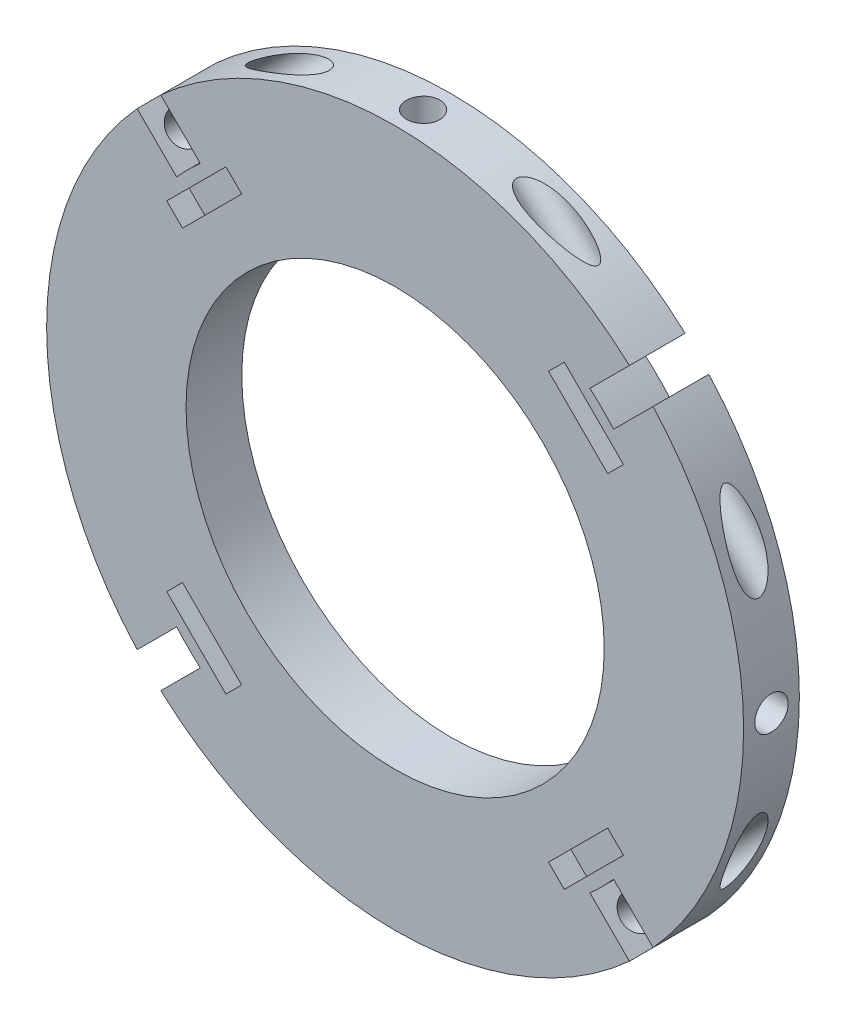
from build123d import *

# Parameters (mm, degrees)
SKETCH1_R                 = 62.5
SKETCH1_R_2               = 37.5
BOSS_EXTRUDE1_DEPTH       = 5
KANAT_B_LMESI_DEPTH       = 10
SKETCH3_R                 = 3
KANAT_TUTUCU_DELI_I_DEPTH = 54.5
MERKEZLEME_START          = 55
SKETCH4_R                 = 3
MERKEZLEME_DELI_I_DEPTH   = 8
MD_AYNA_COUNT             = 4
KB_AYNA_COUNT             = 4
CUT_EXTRUDE4_DEPTH        = 4
CIRPATTERN4_COUNT         = 4


with BuildPart() as part:
    # Sketch1 → Boss-Extrude1 (new, symmetric)
    with BuildSketch(Plane.XY):
        Circle(SKETCH1_R)
        Circle(SKETCH1_R_2, mode=Mode.SUBTRACT)
    extrude(amount=BOSS_EXTRUDE1_DEPTH, both=True)

    # Sketch2 → Kanat Bölmesi (cut)
    with BuildSketch(Plane.XY.offset(5)):
        with BuildLine():
            ThreePointArc((46.264553121, 42.021912433), (44.194173824, 44.194173824), (42.021912433, 46.264553121))
            Line((42.021912433, 46.264553121), (34.941126958, 39.183767645))
            ThreePointArc((34.941126958, 39.183767645), (37.123106012, 37.123106012), (39.183767645, 34.941126958))
            Line((39.183767645, 34.941126958), (46.264553121, 42.021912433))
        make_face()
    kanat_b_lmesi = extrude(amount=-KANAT_B_LMESI_DEPTH, mode=Mode.SUBTRACT)

    # Sketch3 → Kanat Tutucu Deliği (cut, symmetric)
    with BuildSketch(Plane(origin=(-2.121320344, 2.121320344, 0), x_dir=(0, 0, -1), z_dir=(0.7071067811865467, -0.7071067811865485, 0))):
        with Locations(Location((0, 57.42795848, 0), (0, 0, 90))):
            Circle(SKETCH3_R)
    kanat_tutucu_deli_i = extrude(amount=KANAT_TUTUCU_DELI_I_DEPTH, both=True, mode=Mode.SUBTRACT)

    # Sketch4 → Merkezleme Deliği (cut)
    with BuildSketch(Plane(origin=(0, 0, 0), x_dir=(1, 0, 0), z_dir=(0, 1, 0)).offset(MERKEZLEME_START)):
        with Locations(Location((0, 0, 0), (0, 0, 90))):
            Circle(SKETCH4_R)
    merkezleme_deli_i = extrude(amount=MERKEZLEME_DELI_I_DEPTH, mode=Mode.SUBTRACT)

    # MD Ayna: Merkezleme Deliği ×4 about axis
    md_ayna_axis = Axis((0, 0, 0), (0, 0, 1))
    for i in range(1, MD_AYNA_COUNT):
        add(merkezleme_deli_i.rotate(md_ayna_axis, i * 360 / MD_AYNA_COUNT), mode=Mode.SUBTRACT)

    # KB Ayna: Kanat Bölmesi, Kanat Tutucu Deliği ×4 about axis
    kb_ayna_axis = Axis((0, 0, 0), (0, 0, 1))
    add([kanat_b_lmesi.rotate(kb_ayna_axis, i * 360 / KB_AYNA_COUNT) for i in range(1, KB_AYNA_COUNT)], mode=Mode.SUBTRACT)
    add([kanat_tutucu_deli_i.rotate(kb_ayna_axis, i * 360 / KB_AYNA_COUNT) for i in range(1, KB_AYNA_COUNT)], mode=Mode.SUBTRACT)

    # Sketch5 → Cut-Extrude4 (cut)
    with BuildSketch(Plane.XY.offset(5)):
        Polygon((38.123107474, 27.516505756), (40.951534598, 30.344932881), (30.344932881, 40.951534598), (27.516505756, 38.123107474), align=None)
    cut_extrude4 = extrude(amount=-CUT_EXTRUDE4_DEPTH, mode=Mode.SUBTRACT)

    # CirPattern4: Cut-Extrude4 ×4 about axis
    cirpattern4_axis = Axis((0, 0, 0), (0, 0, 1))
    for i in range(1, CIRPATTERN4_COUNT):
        add(cut_extrude4.rotate(cirpattern4_axis, i * 360 / CIRPATTERN4_COUNT), mode=Mode.SUBTRACT)


solid = part.part
